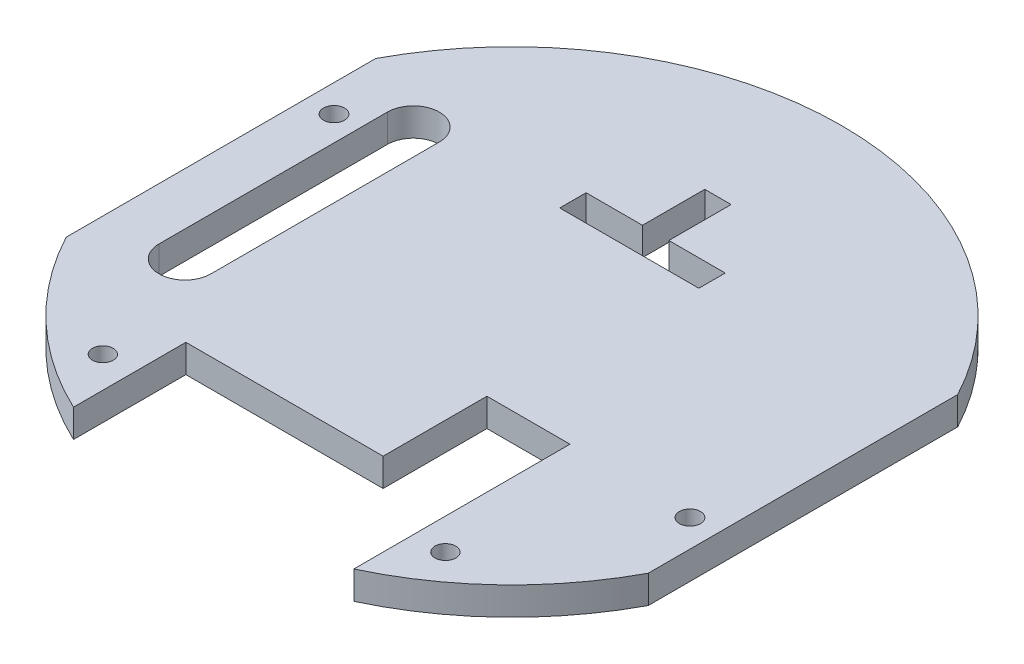
from build123d import *

# Parameters (mm, degrees)
SKETCH1_W          = 13.4
SKETCH1_H          = 2.54
BASE_DEPTH         = 2.7
WHEEL_HOLE_REACH   = 44.441
SKETCH9_R          = 1.016
CHIP_HOLDING_DEPTH = 43.440952488
NUB_SLOT_REACH     = 44.441
SKETCH10_W         = 2.54
SKETCH10_H         = 6
SKETCH11_R         = 1
CUT_EXTRUDE1_DEPTH = 10


with BuildPart() as part:
    # Sketch1 → Base (new body)
    with BuildSketch(Plane(origin=(0, 0, 0), x_dir=(1, 0, 0), z_dir=(0, 1, 0))):
        with BuildLine():
            Line((28.033586073, 14.905722118), (28.033586073, -14.905722118))
            ThreePointArc((28.033586073, -14.905722118), (0, -31.75), (-28.033586073, -14.905722118))
            Line((-28.033586073, -14.905722118), (-28.033586073, 14.905722118))
            ThreePointArc((-28.033586073, 14.905722118), (0, 31.75), (28.033586073, 14.905722118))
        make_face()
        with Locations((0, 12.57)):
            Rectangle(SKETCH1_W, SKETCH1_H, mode=Mode.SUBTRACT)
    extrude(amount=BASE_DEPTH)

    # Sketch2 → Wheel Hole (cut, up to next)
    with BuildSketch(Plane(origin=(0, 2.7, 0), x_dir=(-1, 0, 0), z_dir=(0, 1, 0)), mode=Mode.PRIVATE) as wheel_hole_sk1:
        with BuildLine():
            Line((18, -11), (18, 11))
            ThreePointArc((18, 11), (20.5, 13.5), (23, 11))
            Line((23, 11), (23, -11))
            ThreePointArc((23, -11), (20.5, -13.5), (18, -11))
        make_face()
    wheel_hole_tool1 = extrude(wheel_hole_sk1.sketch, amount=-WHEEL_HOLE_REACH, mode=Mode.PRIVATE) & part.part
    add(wheel_hole_tool1.solids().sort_by_distance((-20.5, 2.7, 0))[0], mode=Mode.SUBTRACT)

    # Sketch9 → Chip Holding (cut, through all)
    with BuildSketch(Plane(origin=(0, 2.7, 0), x_dir=(-1, 0, 0), z_dir=(0, 1, 0))):
        with Locations(Location((25.4, -8.255, 0), (0, 0, 90))):
            Circle(SKETCH9_R)
        with Locations(Location((-25.4, 8.255, 0), (0, 0, 90))):
            Circle(SKETCH9_R)
    extrude(amount=-CHIP_HOLDING_DEPTH, mode=Mode.SUBTRACT)

    # Sketch10 → Nub Slot (cut, up to next)
    with BuildSketch(Plane.XZ, mode=Mode.PRIVATE) as nub_slot_sk1:
        with Locations((0, -16.84)):
            Rectangle(SKETCH10_W, SKETCH10_H)
    nub_slot_tool1 = extrude(nub_slot_sk1.sketch, amount=-NUB_SLOT_REACH, mode=Mode.PRIVATE) & part.part
    add(nub_slot_tool1.solids().sort_by_distance((0, 0, -16.84))[0], mode=Mode.SUBTRACT)

    # Sketch11 → Cut-Extrude1 (cut)
    with BuildSketch(Plane(origin=(0, 2.7, 0), x_dir=(1, 0, 0), z_dir=(0, 1, 0))):
        with Locations(Location((16.5, -22.91366528, 0), (0, 0, 270))):
            Circle(SKETCH11_R)
        with Locations(Location((-16.5, -22.91366528, 0), (0, 0, 270))):
            Circle(SKETCH11_R)
        Polygon((-13.5, -31.75), (13.5, -31.75), (13.5, -17.91366528), (13.5, -7.91366528), (5.5, -7.91366528), (5.5, -17.91366528), (-13.5, -17.91366528), align=None)
    extrude(amount=-CUT_EXTRUDE1_DEPTH, mode=Mode.SUBTRACT)


solid = part.part
